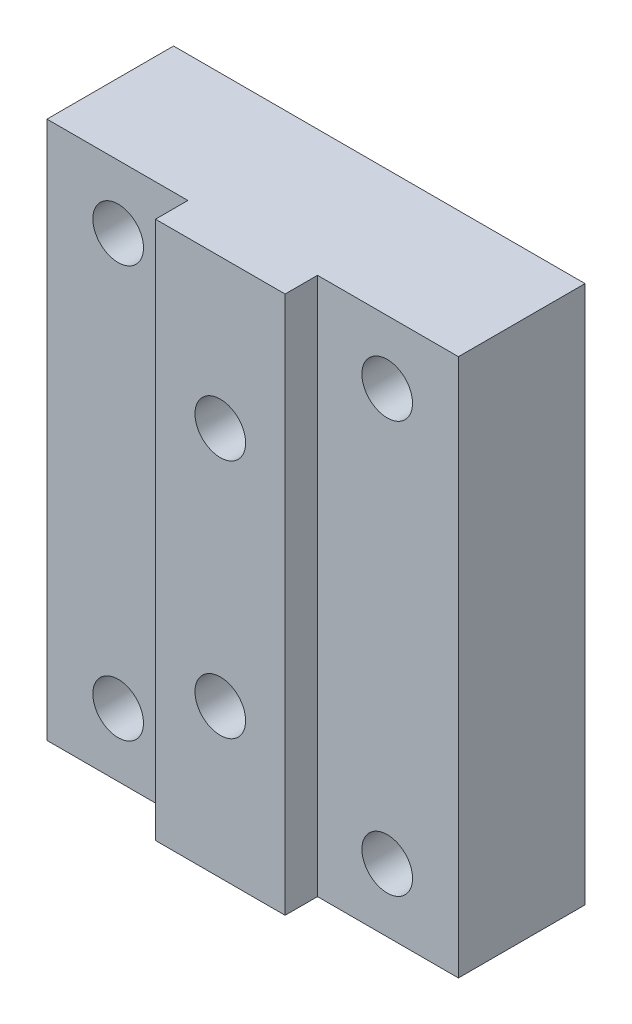
from build123d import *

# Parameters (mm, degrees)
SKETCH1_W           = 1651
SKETCH1_H           = 2159
SKETCH1_R           = 101.6
BOSS_EXTRUDE1_DEPTH = 508
BOSS_EXTRUDE2_START = 130
SKETCH2_W           = 520
SKETCH2_H           = 2159
SKETCH2_R           = 101.6
BOSS_EXTRUDE2_DEPTH = 130


with BuildPart() as part:
    # Sketch1 → Boss-Extrude1 (new body)
    with BuildSketch(Plane.XY.offset(508)):
        with Locations((825.5, 1079.5)):
            Rectangle(SKETCH1_W, SKETCH1_H)
        with Locations(Location((285.75, 254, 0), (0, 0, 180))):
            Circle(SKETCH1_R, mode=Mode.SUBTRACT)
        with Locations(Location((1365.25, 1905, 0), (0, 0, 180))):
            Circle(SKETCH1_R, mode=Mode.SUBTRACT)
        with Locations(Location((825.5, 1562.1, 0), (0, 0, 180))):
            Circle(SKETCH1_R, mode=Mode.SUBTRACT)
        with Locations(Location((285.75, 1905, 0), (0, 0, 180))):
            Circle(SKETCH1_R, mode=Mode.SUBTRACT)
        with Locations(Location((1365.25, 254, 0), (0, 0, 180))):
            Circle(SKETCH1_R, mode=Mode.SUBTRACT)
        with Locations(Location((825.5, 596.9, 0), (0, 0, 180))):
            Circle(SKETCH1_R, mode=Mode.SUBTRACT)
    extrude(amount=-BOSS_EXTRUDE1_DEPTH)

    # Sketch2 → Boss-Extrude2 (add)
    with BuildSketch(Plane.XY.offset(508).offset(BOSS_EXTRUDE2_START)):
        with Locations((825.5, 1079.5)):
            Rectangle(SKETCH2_W, SKETCH2_H)
        with Locations((825.5, 596.9)):
            Circle(SKETCH2_R, mode=Mode.SUBTRACT)
        with Locations((825.5, 1562.1)):
            Circle(SKETCH2_R, mode=Mode.SUBTRACT)
    extrude(amount=-BOSS_EXTRUDE2_DEPTH)


solid = part.part
